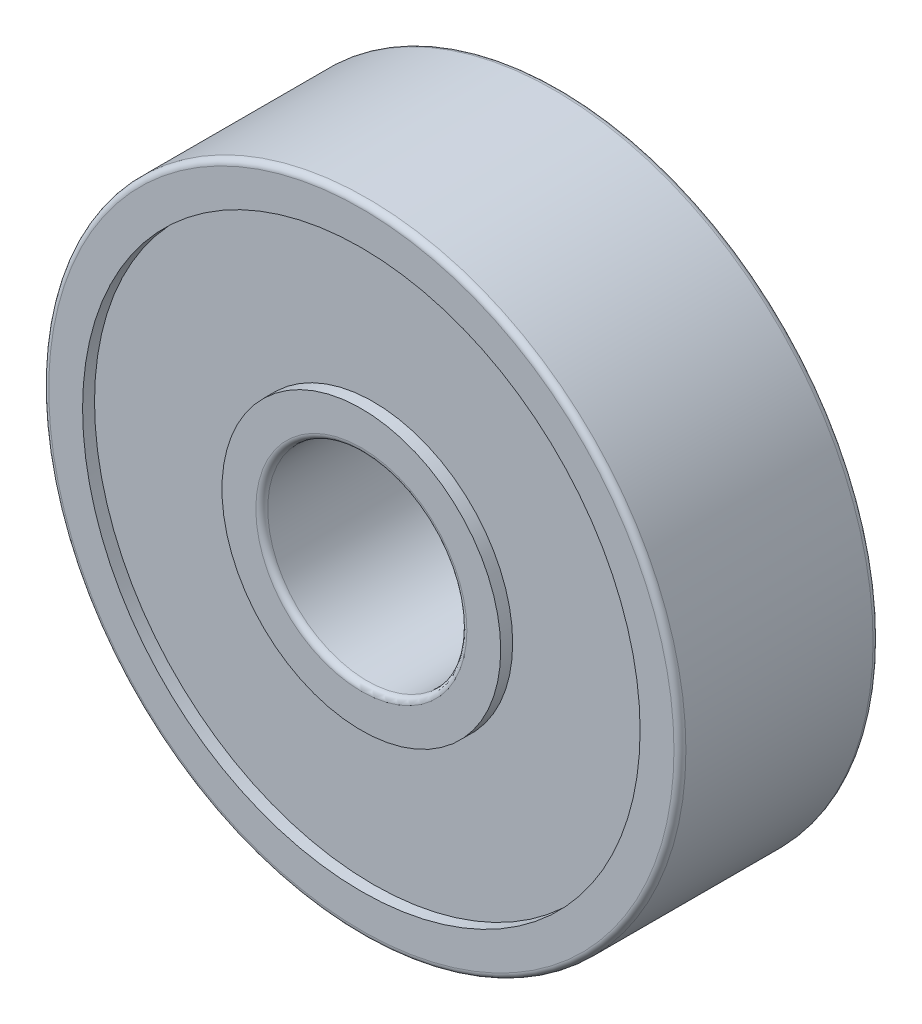
from build123d import *

# Parameters (mm, degrees)
SKETCH1_R           = 8
SKETCH1_R_2         = 2.5
BOSS_EXTRUDE1_DEPTH = 5
SKETCH2_R           = 7
SKETCH2_R_2         = 3.5
CUT_EXTRUDE1_DEPTH  = 0.3
CUT_EXTRUDE2_START  = -4.5
SKETCH2_2_R         = 7
SKETCH2_2_R_2       = 3.5
CUT_EXTRUDE2_DEPTH  = 0.5
FILLET1_R           = 0.15


with BuildPart() as part:
    # Sketch1 → Boss-Extrude1 (new body)
    with BuildSketch(Plane.XY):
        Circle(SKETCH1_R)
        Circle(SKETCH1_R_2, mode=Mode.SUBTRACT)
    extrude(amount=BOSS_EXTRUDE1_DEPTH)

    # Sketch2 → Cut-Extrude1 (cut)
    with BuildSketch(Plane.XY.offset(5)):
        Circle(SKETCH2_R)
        Circle(SKETCH2_R_2, mode=Mode.SUBTRACT)
    extrude(amount=-CUT_EXTRUDE1_DEPTH, mode=Mode.SUBTRACT)

    # Sketch2<2> → Cut-Extrude2 (cut)
    with BuildSketch(Plane.XY.offset(5).offset(CUT_EXTRUDE2_START)):
        Circle(SKETCH2_2_R)
        Circle(SKETCH2_2_R_2, mode=Mode.SUBTRACT)
    extrude(amount=-CUT_EXTRUDE2_DEPTH, mode=Mode.SUBTRACT)

    # Fillet1
    fillet1_edges = [part.edges().sort_by_distance(p)[0] for p in [
        (-8, 0, 0),
        (-8, 0, 5),
        (-2.5, 0, 0),
        (-2.5, 0, 5),
    ]]
    fillet(fillet1_edges, radius=FILLET1_R)


solid = part.part
